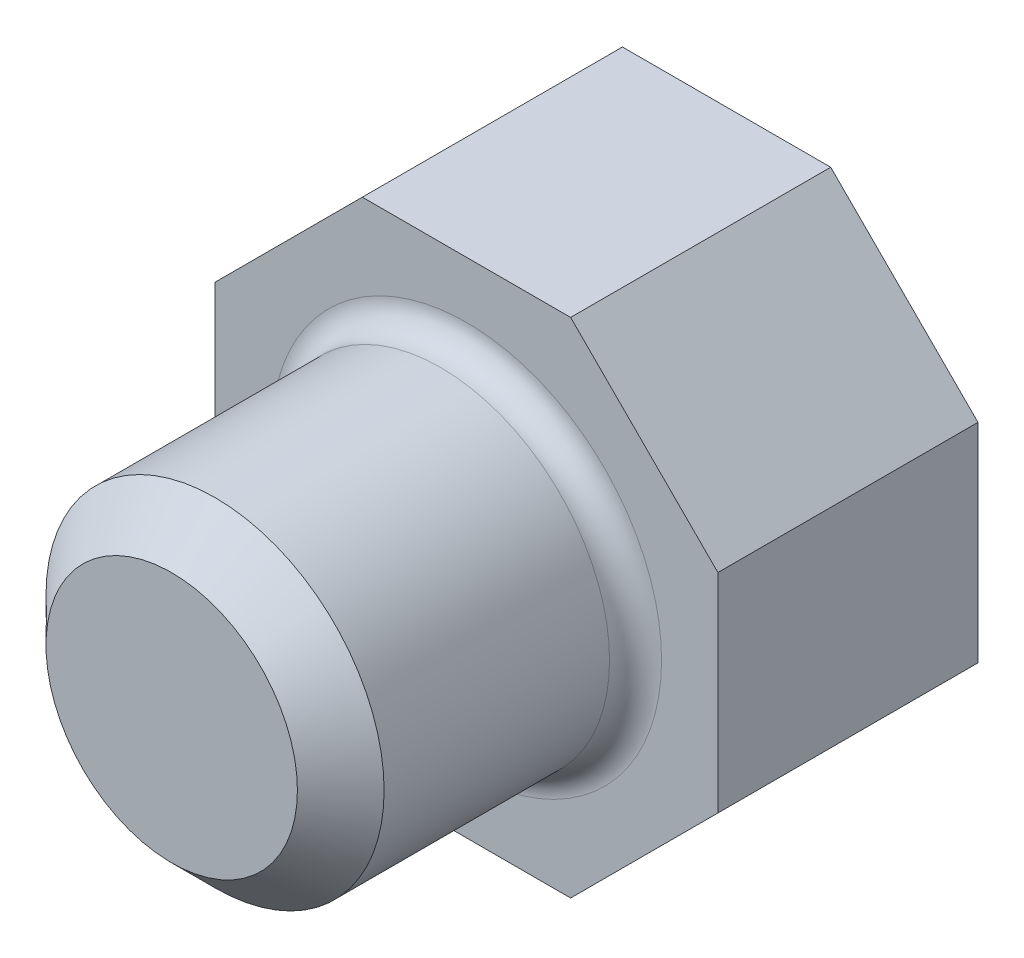
from build123d import *

# Parameters (mm, degrees)
SALIENTE_EXTRUIR1_DEPTH = 6
CROQUIS2_R              = 3.9
SALIENTE_EXTRUIR2_DEPTH = 6.8
CHAFL_N1_SIZE           = 1
REDONDEO1_R             = 0.6


with BuildPart() as part:
    # Croquis1 → Saliente-Extruir1 (new body)
    with BuildSketch(Plane(origin=(0, 0, 0), x_dir=(0, 1, 0), z_dir=(0, 0, 1))):
        Polygon((5.8, -2.402438662), (5.8, 2.402438662), (2.402438662, 5.8), (-2.402438662, 5.8), (-5.8, 2.402438662), (-5.8, -2.402438662), (-2.402438662, -5.8), (2.402438662, -5.8), align=None)
    extrude(amount=SALIENTE_EXTRUIR1_DEPTH)

    # Croquis2 → Saliente-Extruir2 (add)
    with BuildSketch(Plane.XY.offset(6)):
        Circle(CROQUIS2_R)
    extrude(amount=SALIENTE_EXTRUIR2_DEPTH)

    # Chaflán1
    chafl_n1_edges = [part.edges().sort_by_distance(p)[0] for p in [
        (-3.9, 0, 12.8),
    ]]
    chamfer(chafl_n1_edges, length=CHAFL_N1_SIZE)

    # Redondeo1
    redondeo1_edges = [part.edges().sort_by_distance(p)[0] for p in [
        (-3.9, 0, 6),
    ]]
    fillet(redondeo1_edges, radius=REDONDEO1_R)


solid = part.part
